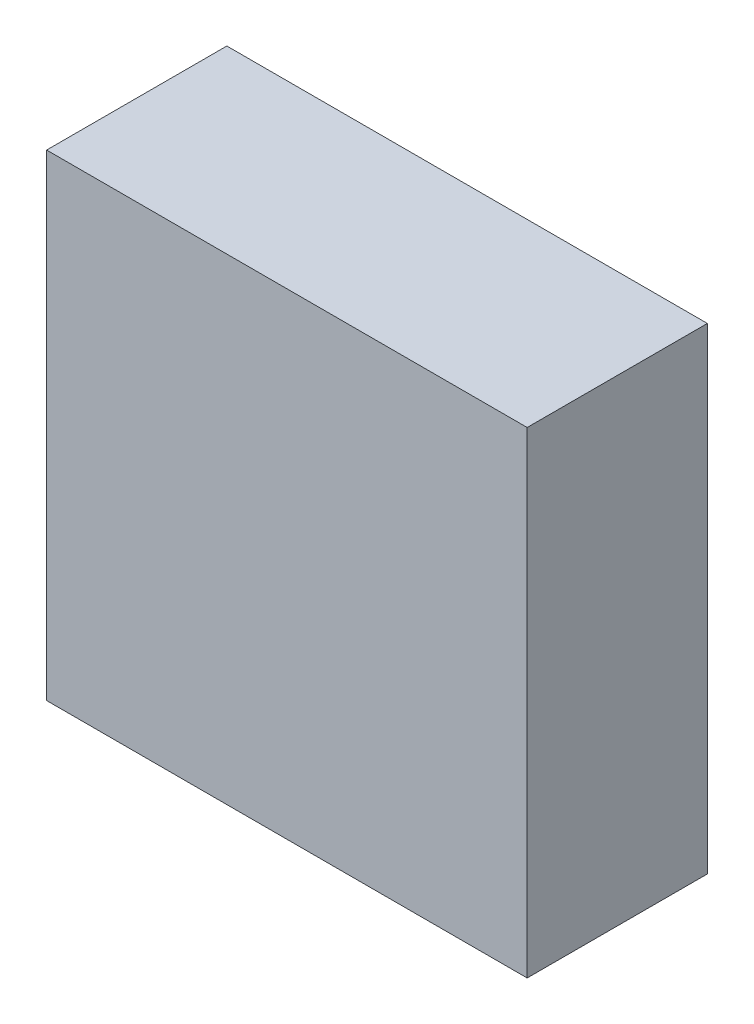
from build123d import *

# Parameters (mm, degrees)
SKETCH1_W           = 128
SKETCH1_H           = 127
BOSS_EXTRUDE1_DEPTH = 48


with BuildPart() as part:
    # Sketch1 → Boss-Extrude1 (new body)
    with BuildSketch(Plane.XY):
        Rectangle(SKETCH1_W, SKETCH1_H)
    extrude(amount=BOSS_EXTRUDE1_DEPTH)


solid = part.part
